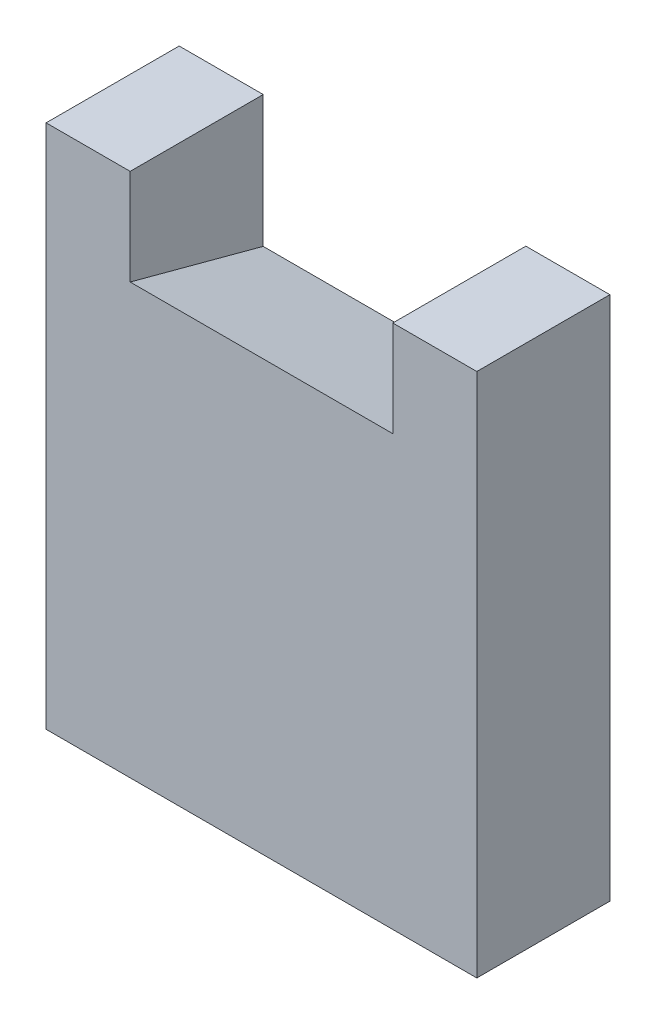
from build123d import *

# Parameters (mm, degrees)
EXTRUDE_1_DEPTH = 7.6
DRAFT_5_ANGLE   = -15


with BuildPart() as part:
    # 草图1 → 凸台-拉伸1 (new body)
    with BuildSketch(Plane.XY):
        Polygon((4.8, 0), (0, 0), (0, -30), (24.6, -30), (24.6, 0), (19.8, 0), (19.8, -5.475), (4.8, -5.475), align=None)
    extrude(amount=EXTRUDE_1_DEPTH)

    # 拔模5
    draft_5_faces = [part.faces().sort_by_distance(p)[0] for p in [
        (12.3, -5.475, 3.8),
    ]]
    draft(draft_5_faces, Plane.XY.offset(7.6), DRAFT_5_ANGLE)


solid = part.part
